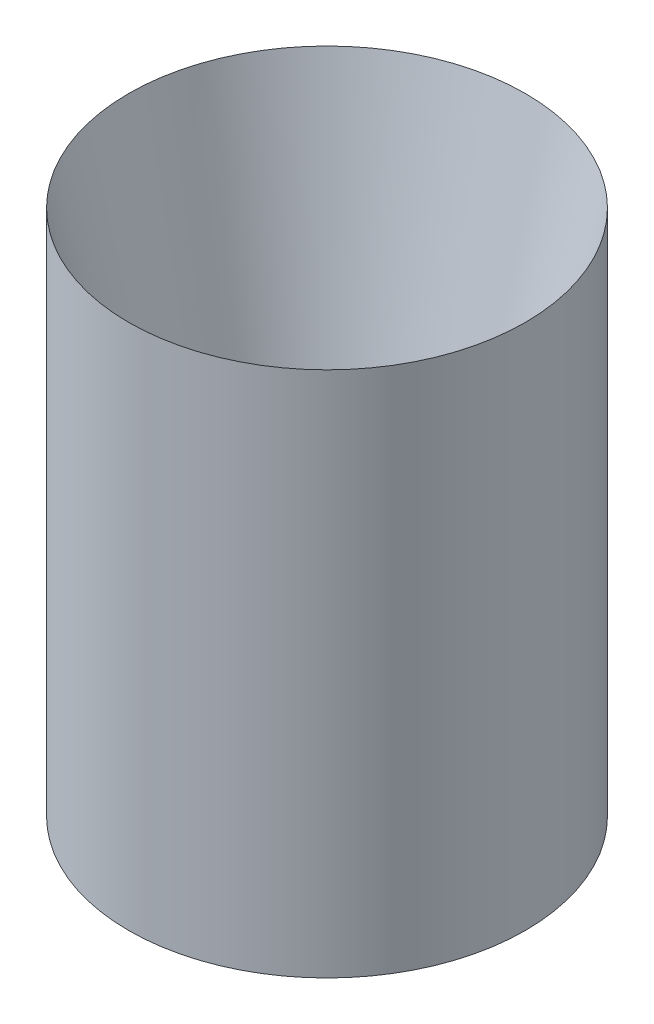
from build123d import *


with BuildPart() as part:
    # Sketch1 → Revolve1 (revolve)
    with BuildSketch(Plane(origin=(0, 0, 0), x_dir=(0, 1, 0), z_dir=(0, 0, 1)), mode=Mode.PRIVATE) as revolve1_sk:
        Polygon((0, 22.225), (0, 53.848), (143.002, 53.848), align=None)
    revolve(revolve1_sk.sketch.rotate(Axis((0, 0, 0), (0, 1, 0)), 270), axis=Axis((0, 0, 0), (0, 1, 0)))


solid = part.part
